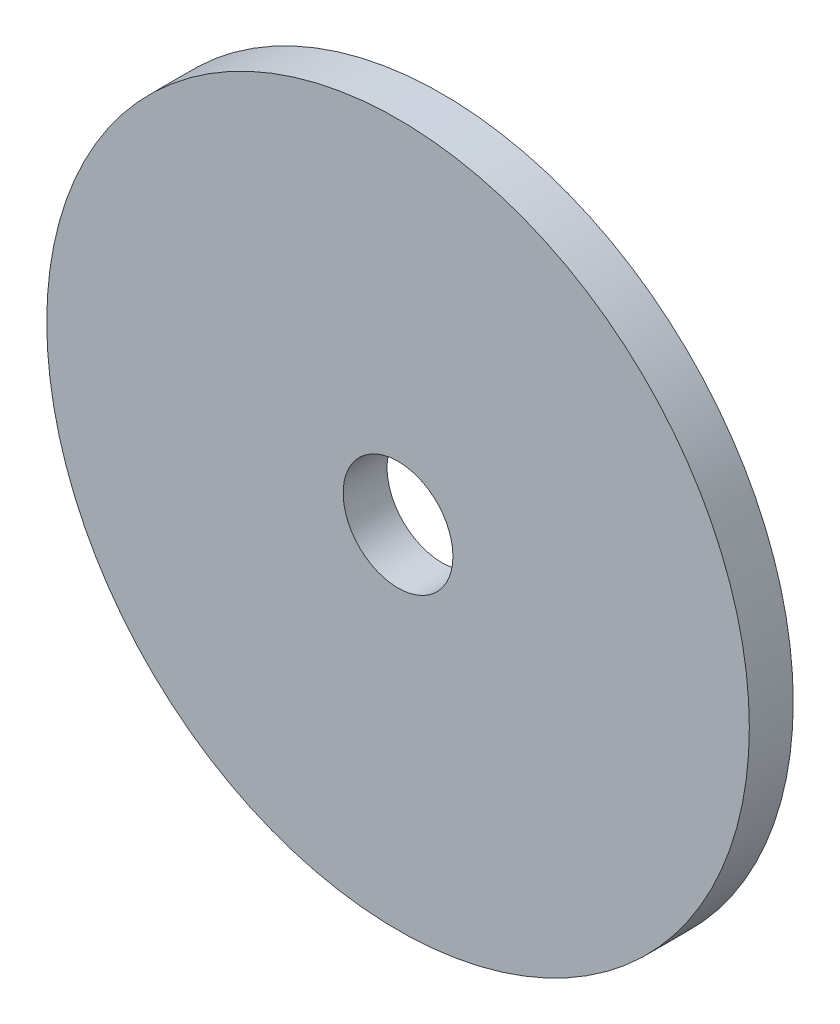
from build123d import *

# Parameters (mm, degrees)
SKETCH1_R           = 120
SKETCH1_R_2         = 18.75
BOSS_EXTRUDE1_DEPTH = 15


with BuildPart() as part:
    # Sketch1 → Boss-Extrude1 (new body)
    with BuildSketch(Plane.XY):
        Circle(SKETCH1_R)
        Circle(SKETCH1_R_2, mode=Mode.SUBTRACT)
    extrude(amount=BOSS_EXTRUDE1_DEPTH)


solid = part.part
